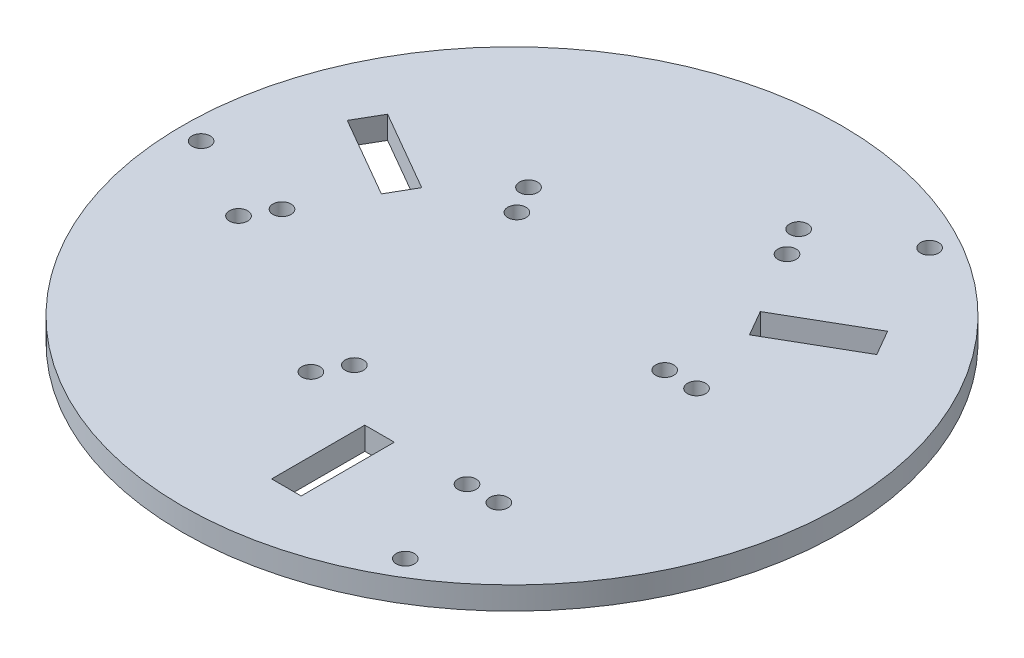
from build123d import *

# Parameters (mm, degrees)
SKETCH1_R           = 72.5
BOSS_EXTRUDE1_DEPTH = 5
CUT_EXTRUDE6_REACH  = 104.652
SKETCH7_R           = 2
CIRPATTERN1_COUNT   = 3


with BuildPart() as part:
    # Sketch1 → Boss-Extrude1 (new body)
    with BuildSketch(Plane(origin=(0, 0, 0), x_dir=(1, 0, 0), z_dir=(0, 1, 0))):
        with Locations(Location((0, 0, 0), (0, 0, 270))):
            Circle(SKETCH1_R)
    extrude(amount=BOSS_EXTRUDE1_DEPTH)

    # Sketch7 → Cut-Extrude6 (cut, up to next)
    with BuildSketch(Plane(origin=(0, 5, 0), x_dir=(1, 0, 0), z_dir=(0, 1, 0)), mode=Mode.PRIVATE) as cut_extrude6_sk1:
        with Locations(Location((15, 48.062177826, 0), (0, 0, 270))):
            Circle(SKETCH7_R)
    cut_extrude6_tool1 = extrude(cut_extrude6_sk1.sketch, amount=-CUT_EXTRUDE6_REACH, mode=Mode.PRIVATE) & part.part
    # Sketch7 → Cut-Extrude6 (cut, up to next)
    with BuildSketch(Plane(origin=(0, 5, 0), x_dir=(1, 0, 0), z_dir=(0, 1, 0)), mode=Mode.PRIVATE) as cut_extrude6_sk2:
        with Locations(Location((18.5, 42, 0), (0, 0, 270))):
            Circle(SKETCH7_R)
    cut_extrude6_tool2 = extrude(cut_extrude6_sk2.sketch, amount=-CUT_EXTRUDE6_REACH, mode=Mode.PRIVATE) & part.part
    # Sketch7 → Cut-Extrude6 (cut, up to next)
    with BuildSketch(Plane(origin=(0, 5, 0), x_dir=(1, 0, 0), z_dir=(0, 1, 0)), mode=Mode.PRIVATE) as cut_extrude6_sk3:
        with Locations(Location((-22.672105065, 26.312177826, 0), (0, 0, 270))):
            Circle(SKETCH7_R)
    cut_extrude6_tool3 = extrude(cut_extrude6_sk3.sketch, amount=-CUT_EXTRUDE6_REACH, mode=Mode.PRIVATE) & part.part
    # Sketch7 → Cut-Extrude6 (cut, up to next)
    with BuildSketch(Plane(origin=(0, 5, 0), x_dir=(1, 0, 0), z_dir=(0, 1, 0)), mode=Mode.PRIVATE) as cut_extrude6_sk4:
        with Locations(Location((-19.172105065, 20.25, 0), (0, 0, 270))):
            Circle(SKETCH7_R)
    cut_extrude6_tool4 = extrude(cut_extrude6_sk4.sketch, amount=-CUT_EXTRUDE6_REACH, mode=Mode.PRIVATE) & part.part
    # Sketch7 → Cut-Extrude6 (cut, up to next)
    with BuildSketch(Plane(origin=(0, 5, 0), x_dir=(1, 0, 0), z_dir=(0, 1, 0)), mode=Mode.PRIVATE) as cut_extrude6_sk5:
        with Locations(Location((32.965163285, 58.902869281, 0), (0, 0, 270))):
            Circle(SKETCH7_R)
    cut_extrude6_tool5 = extrude(cut_extrude6_sk5.sketch, amount=-CUT_EXTRUDE6_REACH, mode=Mode.PRIVATE) & part.part
    # Sketch7 → Cut-Extrude6 (cut, up to next)
    with BuildSketch(Plane(origin=(0, 5, 0), x_dir=(1, 0, 0), z_dir=(0, 1, 0)), mode=Mode.PRIVATE) as cut_extrude6_sk6:
        Polygon((26.486526778, 28.135814771), (44.240047555, 38.385814771), (47.490047555, 32.756649646), (29.736526778, 22.506649646), align=None)
    cut_extrude6_tool6 = extrude(cut_extrude6_sk6.sketch, amount=-CUT_EXTRUDE6_REACH, mode=Mode.PRIVATE) & part.part
    cut_extrude6_1 = cut_extrude6_tool1.solids().sort_by_distance((15, 5, -48.062178))[0]
    add(cut_extrude6_1, mode=Mode.SUBTRACT)
    cut_extrude6_2 = cut_extrude6_tool2.solids().sort_by_distance((18.5, 5, -42))[0]
    add(cut_extrude6_2, mode=Mode.SUBTRACT)
    cut_extrude6_3 = cut_extrude6_tool3.solids().sort_by_distance((-22.672105, 5, -26.312178))[0]
    add(cut_extrude6_3, mode=Mode.SUBTRACT)
    cut_extrude6_4 = cut_extrude6_tool4.solids().sort_by_distance((-19.172105, 5, -20.25))[0]
    add(cut_extrude6_4, mode=Mode.SUBTRACT)
    cut_extrude6_5 = cut_extrude6_tool5.solids().sort_by_distance((32.965163, 5, -58.902869))[0]
    add(cut_extrude6_5, mode=Mode.SUBTRACT)
    cut_extrude6_6 = cut_extrude6_tool6.solids().sort_by_distance((36.988287, 5, -30.446232))[0]
    add(cut_extrude6_6, mode=Mode.SUBTRACT)
    cut_extrude6 = cut_extrude6_1 + cut_extrude6_2 + cut_extrude6_3 + cut_extrude6_4 + cut_extrude6_5 + cut_extrude6_6  # Cut-Extrude6 as one shape, for the pattern or mirror that repeats it

    # CirPattern1: Cut-Extrude6 ×3 about axis
    cirpattern1_axis = Axis((0, 0, 0), (0, 1, 0))
    for i in range(1, CIRPATTERN1_COUNT):
        add(cut_extrude6.rotate(cirpattern1_axis, i * 360 / CIRPATTERN1_COUNT), mode=Mode.SUBTRACT)


solid = part.part
